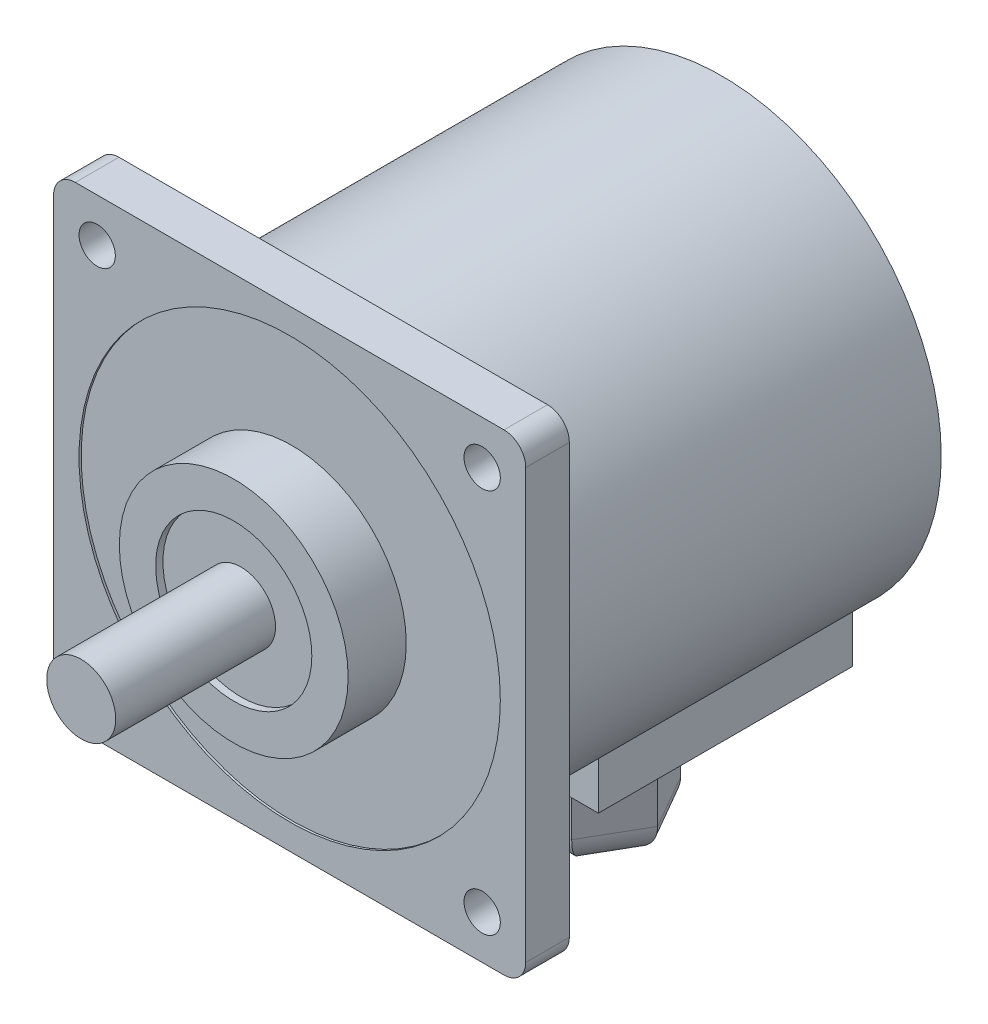
from build123d import *

# Parameters (mm, degrees)
IZIM1_W                        = 65
IZIM1_H                        = 65
Y_KSEKLIK_EKSTR_ZYON1_DEPTH    = 6
IZIM2_R                        = 30.2
Y_KSEKLIK_EKSTR_ZYON2_DEPTH    = 53.5
IZIM3_W                        = 36
IZIM3_H                        = 6.950463922
Y_KSEKLIK_EKSTR_ZYON3_DEPTH    = 35
IZIM5_R                        = 1.5
KES_EKSTR_ZYON2_DEPTH          = 10
Y_KSEKLIK_EKSTR_ZYON7_START    = 10
IZIM31_R                       = 1.5
Y_KSEKLIK_EKSTR_ZYON7_DEPTH    = 10
M3_SFHCS_IN_HAV_A5_D           = 3.2
M3_SFHCS_IN_HAV_A5_DEPTH       = 10
M3_SFHCS_IN_HAV_A5_CSINK_D     = 6.72
M3_SFHCS_IN_HAV_A5_CSINK_ANGLE = 90
M3_SFHCS_IN_HAV_A5_TIP         = 0.96137699
Y_KSEKLIK_EKSTR_ZYON8_DEPTH    = 19
RADYUS1_R                      = 4
IZIM35_R                       = 29
KES_EKSTR_ZYON3_DEPTH          = 0.3
IZIM36_R                       = 15.75
Y_KSEKLIK_EKSTR_ZYON9_DEPTH    = 8
IZIM37_R                       = 10.75
KES_EKSTR_ZYON4_DEPTH          = 1
IZIM38_R                       = 4.75
Y_KSEKLIK_EKSTR_ZYON10_DEPTH   = 22
IZIM39_R                       = 2.5
KES_EKSTR_ZYON5_DEPTH          = 10
RADYUS2_R                      = 3


with BuildPart() as part:
    # Çizim1 → Yükseklik-Ekstrüzyon1 (new body)
    with BuildSketch(Plane.XY):
        Rectangle(IZIM1_W, IZIM1_H)
    extrude(amount=Y_KSEKLIK_EKSTR_ZYON1_DEPTH)

    # Çizim2 → Yükseklik-Ekstrüzyon2 (add)
    with BuildSketch(Plane(origin=(0, 0, 0), x_dir=(-1, 0, 0), z_dir=(0, 0, -1))):
        Circle(IZIM2_R)
    extrude(amount=Y_KSEKLIK_EKSTR_ZYON2_DEPTH)

    # Çizim3 → Yükseklik-Ekstrüzyon3 (add)
    with BuildSketch(Plane(origin=(0, 0, -53.5), x_dir=(-1, 0, 0), z_dir=(0, 0, -1))):
        with Locations((0, -27.724768039)):
            Rectangle(IZIM3_W, IZIM3_H)
    extrude(amount=-Y_KSEKLIK_EKSTR_ZYON3_DEPTH)

    # Çizim5 → Kes-Ekstrüzyon2 (cut)
    with BuildSketch(Plane(origin=(0, 0, -53.5), x_dir=(-1, 0, 0), z_dir=(0, 0, -1))):
        with Locations((0, 25.2)):
            Circle(IZIM5_R)
        with Locations((-17.819090886, -17.819090886)):
            Circle(IZIM5_R)
        with Locations((17.819090886, -17.819090886)):
            Circle(IZIM5_R)
    extrude(amount=-KES_EKSTR_ZYON2_DEPTH, mode=Mode.SUBTRACT)

    # Çizim31 → Yükseklik-Ekstrüzyon7 (add)
    with BuildSketch(Plane(origin=(0, 0, -43.5), x_dir=(-1, 0, 0), z_dir=(0, 0, -1)).offset(Y_KSEKLIK_EKSTR_ZYON7_START)):
        with Locations((0, 25.2)):
            Circle(IZIM31_R)
        with Locations((17.819090886, -17.819090886)):
            Circle(IZIM31_R)
        with Locations((-17.819090886, -17.819090886)):
            Circle(IZIM31_R)
    extrude(amount=-Y_KSEKLIK_EKSTR_ZYON7_DEPTH)

    # M3 SFHCS İçin Havşa5
    with Locations(Plane(origin=(0, 0, -53.5), x_dir=(-1, 0, 0), z_dir=(0, 0, -1))):
        with Locations((0, 25.2), (-17.819090886, -17.819090886), (17.819090886, -17.819090886)):
            CounterSinkHole(M3_SFHCS_IN_HAV_A5_D / 2, M3_SFHCS_IN_HAV_A5_CSINK_D / 2, depth=M3_SFHCS_IN_HAV_A5_DEPTH, counter_sink_angle=M3_SFHCS_IN_HAV_A5_CSINK_ANGLE)
            with Locations((0, 0, -(M3_SFHCS_IN_HAV_A5_DEPTH + M3_SFHCS_IN_HAV_A5_TIP / 2))):  # 118° drill point
                Cone(0, M3_SFHCS_IN_HAV_A5_D / 2, M3_SFHCS_IN_HAV_A5_TIP, mode=Mode.SUBTRACT)

    # Çizim34 → Yükseklik-Ekstrüzyon8 (add)
    with BuildSketch(Plane.XZ.offset(31.2)):
        Polygon((-8.660254038, -36), (-4.330127019, -43.5), (4.330127019, -43.5), (8.660254038, -36), (4.330127019, -28.5), (-4.330127019, -28.5), align=None)
    extrude(amount=Y_KSEKLIK_EKSTR_ZYON8_DEPTH)

    # Radyus1
    radyus1_edges = [part.edges().sort_by_distance(p)[0] for p in [
        (-6.495190528, -50.2, -32.25),
        (-6.495190528, -50.2, -39.75),
        (0, -50.2, -43.5),
        (6.495190528, -50.2, -39.75),
        (6.495190528, -50.2, -32.25),
        (0, -50.2, -28.5),
    ]]
    fillet(radyus1_edges, radius=RADYUS1_R)

    # Çizim35 → Kes-Ekstrüzyon3 (cut)
    with BuildSketch(Plane.XY.offset(6)):
        Circle(IZIM35_R)
    extrude(amount=-KES_EKSTR_ZYON3_DEPTH, mode=Mode.SUBTRACT)

    # Çizim36 → Yükseklik-Ekstrüzyon9 (add)
    with BuildSketch(Plane.XY.offset(5.7)):
        Circle(IZIM36_R)
    extrude(amount=Y_KSEKLIK_EKSTR_ZYON9_DEPTH)

    # Çizim37 → Kes-Ekstrüzyon4 (cut)
    with BuildSketch(Plane.XY.offset(13.7)):
        Circle(IZIM37_R)
    extrude(amount=-KES_EKSTR_ZYON4_DEPTH, mode=Mode.SUBTRACT)

    # Çizim38 → Yükseklik-Ekstrüzyon10 (add)
    with BuildSketch(Plane.XY.offset(12.7)):
        Circle(IZIM38_R)
    extrude(amount=Y_KSEKLIK_EKSTR_ZYON10_DEPTH)

    # Çizim39 → Kes-Ekstrüzyon5 (cut)
    with BuildSketch(Plane.XY.offset(6)):
        with Locations((26.5, -26.5)):
            Circle(IZIM39_R)
        with Locations((-26.5, -26.5)):
            Circle(IZIM39_R)
        with Locations((-26.5, 26.5)):
            Circle(IZIM39_R)
        with Locations((26.5, 26.5)):
            Circle(IZIM39_R)
    extrude(amount=-KES_EKSTR_ZYON5_DEPTH, mode=Mode.SUBTRACT)

    # Radyus2
    radyus2_edges = [part.edges().sort_by_distance(p)[0] for p in [
        (-32.5, 32.5, 3),
        (32.5, 32.5, 3),
        (32.5, -32.5, 3),
        (-32.5, -32.5, 3),
    ]]
    fillet(radyus2_edges, radius=RADYUS2_R)


solid = part.part
